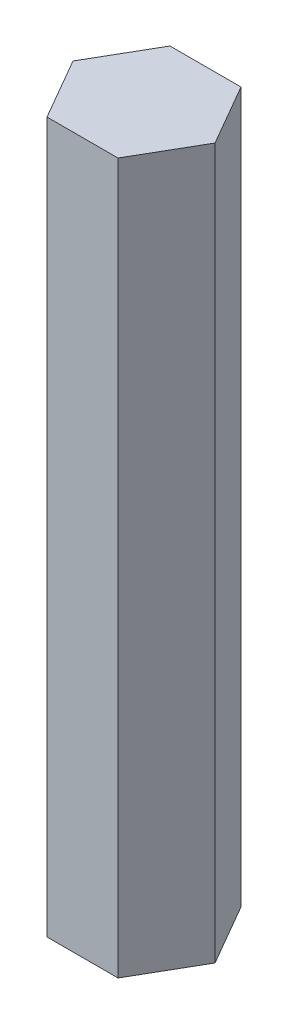
from build123d import *

# Parameters (mm, degrees)
BOSS_EXTRUDE1_DEPTH = 30
SKETCH3_R           = 1.6
CUT_EXTRUDE1_DEPTH  = 5


with BuildPart() as part:
    # Sketch1 → Boss-Extrude1 (new body)
    with BuildSketch(Plane(origin=(0, 0, 0), x_dir=(1, 0, 0), z_dir=(0, 1, 0))):
        Polygon((3, 0), (1.5, 2.598076211), (-1.5, 2.598076211), (-3, 0), (-1.5, -2.598076211), (1.5, -2.598076211), align=None)
    extrude(amount=BOSS_EXTRUDE1_DEPTH)

    # Sketch3 → Cut-Extrude1 (cut)
    with BuildSketch(Plane.XZ):
        with Locations(Location((0, 0, 0), (0, 0, 270))):
            Circle(SKETCH3_R)
    extrude(amount=-CUT_EXTRUDE1_DEPTH, mode=Mode.SUBTRACT)


solid = part.part
